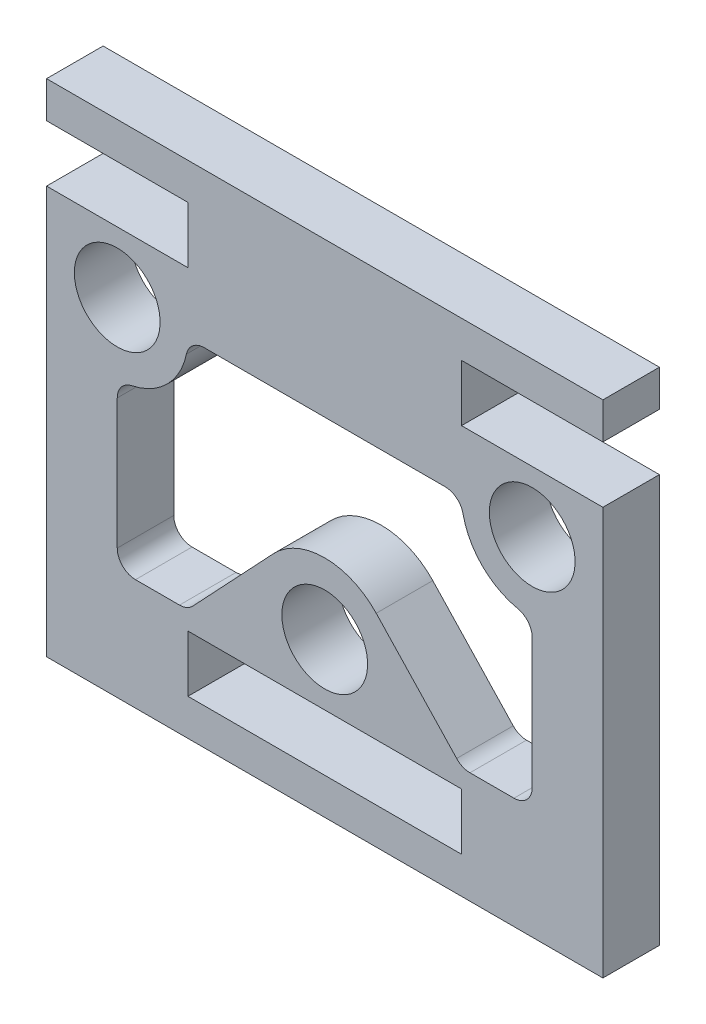
from build123d import *

# Parameters (mm, degrees)
SKETCH1_R      = 2.35
SKETCH1_W      = 15
SKETCH1_H      = 3.1
EXTRUDE1_DEPTH = 3.1


with BuildPart() as part:
    # Sketch1 → Extrude1 (new body)
    with BuildSketch(Plane.XY):
        Polygon((-41.013157114, 34.508489293), (-10.513157114, 34.508489293), (-10.513157114, 32.508489293), (-18.263157114, 32.508489293), (-18.263157114, 29.408489293), (-10.513157114, 29.408489293), (-10.513157114, 7.058489293), (-41.013157114, 7.058489293), (-41.013157114, 29.408489293), (-33.263157114, 29.408489293), (-33.263157114, 32.508489293), (-41.013157114, 32.508489293), align=None)
        with Locations(Location((-14.388157114, 26.058489293, 0), (0, 0, 180))):
            Circle(SKETCH1_R, mode=Mode.SUBTRACT)
        with Locations(Location((-37.138157114, 26.058489293, 0), (0, 0, 180))):
            Circle(SKETCH1_R, mode=Mode.SUBTRACT)
        with Locations(Location((-25.763157114, 15.508489293, 0), (0, 0, 180))):
            Circle(SKETCH1_R, mode=Mode.SUBTRACT)
        with BuildLine():
            Line((-37.138157114, 21.287155622), (-37.138157114, 14.158489293))
            ThreePointArc((-37.138157114, 14.158489293), (-36.845263895, 13.451382512), (-36.138157114, 13.158489293))
            Line((-36.138157114, 13.158489293), (-33.725119975, 13.158489293))
            ThreePointArc((-33.725119975, 13.158489293), (-33.328320215, 13.240584097), (-32.996670851, 13.473389392))
            Line((-32.996670851, 13.473389392), (-28.585897467, 18.16325141))
            ThreePointArc((-28.585897467, 18.16325141), (-25.763157114, 19.383489293), (-22.940416761, 18.16325141))
            Line((-22.940416761, 18.16325141), (-18.529643377, 13.473389392))
            ThreePointArc((-18.529643377, 13.473389392), (-18.197994013, 13.240584097), (-17.801194253, 13.158489293))
            Line((-17.801194253, 13.158489293), (-15.388157114, 13.158489293))
            ThreePointArc((-15.388157114, 13.158489293), (-14.681050333, 13.451382512), (-14.388157114, 14.158489293))
            Line((-14.388157114, 14.158489293), (-14.388157114, 21.287155622))
            ThreePointArc((-14.388157114, 21.287155622), (-14.611907088, 21.917580794), (-15.183028909, 22.265890734))
            ThreePointArc((-15.183028909, 22.265890734), (-17.128195891, 23.318450516), (-18.180755673, 25.263617499))
            ThreePointArc((-18.180755673, 25.263617499), (-18.529065613, 25.834739319), (-19.159490785, 26.058489293))
            Line((-19.159490785, 26.058489293), (-32.366823443, 26.058489293))
            ThreePointArc((-32.366823443, 26.058489293), (-32.997248615, 25.834739319), (-33.345558555, 25.263617499))
            ThreePointArc((-33.345558555, 25.263617499), (-34.398118337, 23.318450516), (-36.343285319, 22.265890734))
            ThreePointArc((-36.343285319, 22.265890734), (-36.91440714, 21.917580794), (-37.138157114, 21.287155622))
        make_face(mode=Mode.SUBTRACT)
        with Locations((-25.763157114, 10.608489293)):
            Rectangle(SKETCH1_W, SKETCH1_H, mode=Mode.SUBTRACT)
    extrude(amount=EXTRUDE1_DEPTH)


solid = part.part
